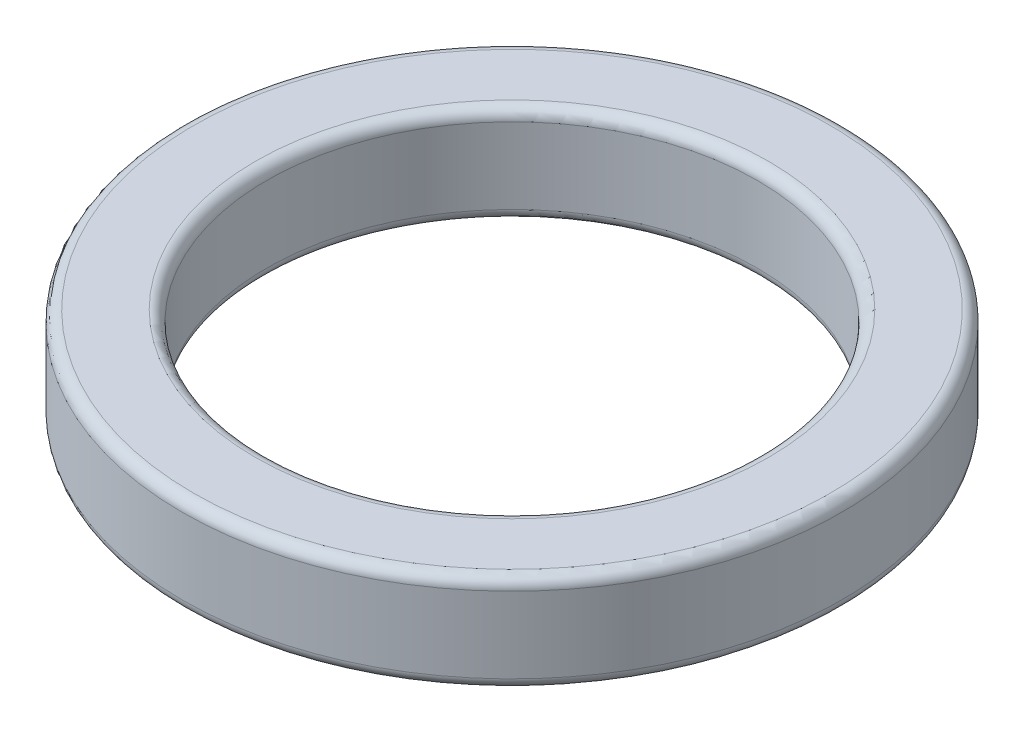
from build123d import *

# Parameters (mm, degrees)
SKETCH1_R           = 23.5
SKETCH1_R_2         = 17.5
BOSS_EXTRUDE1_DEPTH = 3.5
FILLET1_R           = 0.79375


with BuildPart() as part:
    # Sketch1 → Boss-Extrude1 (new, symmetric)
    with BuildSketch(Plane(origin=(0, 0, 0), x_dir=(1, 0, 0), z_dir=(0, 1, 0))):
        with Locations(Location((0, 0, 0), (0, 0, 270))):
            Circle(SKETCH1_R)
        with Locations(Location((0, 0, 0), (0, 0, 270))):
            Circle(SKETCH1_R_2, mode=Mode.SUBTRACT)
    extrude(amount=BOSS_EXTRUDE1_DEPTH, both=True)

    # Fillet1
    fillet1_edges = [part.edges().sort_by_distance(p)[0] for p in [
        (0, -3.5, -23.5),
        (0, 3.5, -23.5),
        (0, -3.5, -17.5),
        (0, 3.5, -17.5),
    ]]
    fillet(fillet1_edges, radius=FILLET1_R)


solid = part.part
